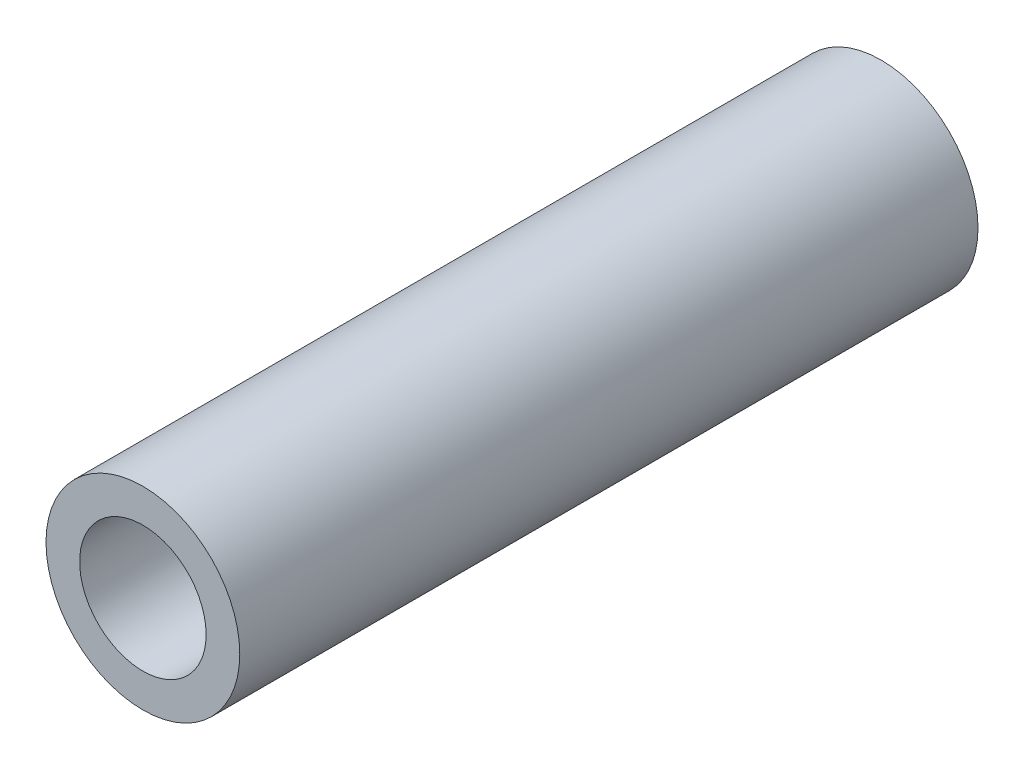
from build123d import *

# Parameters (mm, degrees)
SKETCH1_R             = 2.5
BOSS_EXTRUDE1_DEPTH   = 19.05
F_4_CLEARANCE_HOLE1_D = 3.2639


with BuildPart() as part:
    # Sketch1 → Boss-Extrude1 (new body)
    with BuildSketch(Plane.XY):
        with Locations(Location((0, 0, 0), (0, 0, 180))):
            Circle(SKETCH1_R)
    extrude(amount=BOSS_EXTRUDE1_DEPTH)

    # #4 Clearance Hole1 (through all)
    with Locations(Plane.XY.offset(19.05)):
        with Locations((0, 0)):
            Hole(F_4_CLEARANCE_HOLE1_D / 2)


solid = part.part
